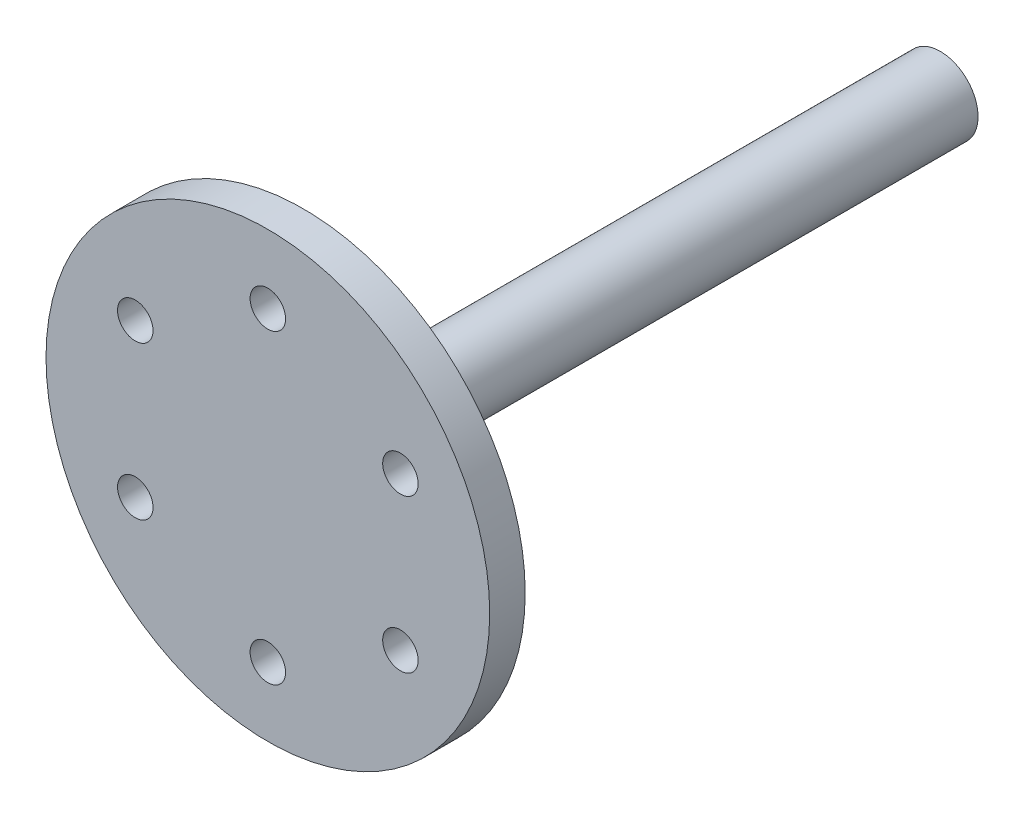
from build123d import *

# Parameters (mm, degrees)
SKETCH_1_R          = 25
EXTRUDE_1_DEPTH     = 4
SKETCH_2_R          = 4.25
EXTRUDE_2_DEPTH     = 72
SKETCH_3_R          = 2
CUT_EXTRUDE_1_DEPTH = 100


with BuildPart() as part:
    # 草图1 → 凸台-拉伸1 (new body)
    with BuildSketch(Plane.XY):
        Circle(SKETCH_1_R)
    extrude(amount=EXTRUDE_1_DEPTH)

    # 草图2 → 凸台-拉伸2 (add)
    with BuildSketch(Plane(origin=(0, 0, 0), x_dir=(-1, 0, 0), z_dir=(0, 0, -1))):
        with Locations((0.21687177, 0)):
            Circle(SKETCH_2_R)
    extrude(amount=EXTRUDE_2_DEPTH)

    # 草图3 → 切除-拉伸1 (cut)
    with BuildSketch(Plane(origin=(0, 0, 0), x_dir=(-1, 0, 0), z_dir=(0, 0, -1))):
        with Locations((0, 17.25)):
            Circle(SKETCH_3_R)
        with Locations((14.938938215, 8.625)):
            Circle(SKETCH_3_R)
        with Locations((14.938938215, -8.625)):
            Circle(SKETCH_3_R)
        with Locations((0, -17.25)):
            Circle(SKETCH_3_R)
        with Locations((-14.938938215, -8.625)):
            Circle(SKETCH_3_R)
        with Locations((-14.938938215, 8.625)):
            Circle(SKETCH_3_R)
    extrude(amount=-CUT_EXTRUDE_1_DEPTH, mode=Mode.SUBTRACT)


solid = part.part
